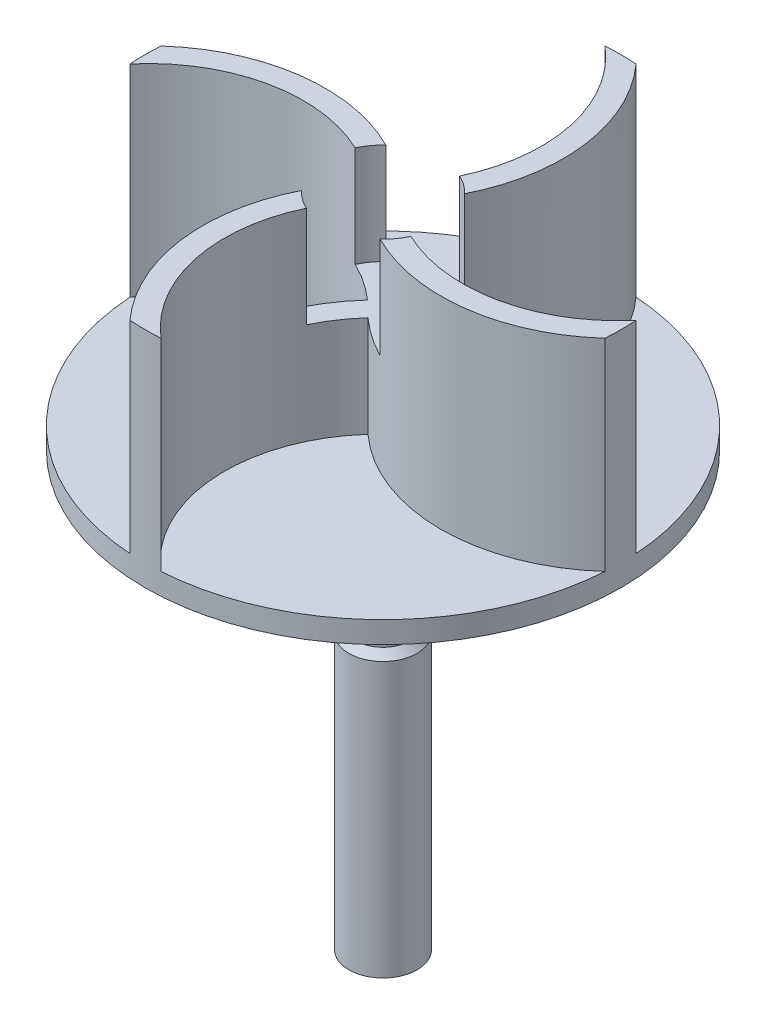
from build123d import *

# Parameters (mm, degrees)
SKETCH1_R           = 33
BOSS_EXTRUDE1_DEPTH = 3
BOSS_EXTRUDE3_DEPTH = 28
CIRPATTERN2_COUNT   = 4
SKETCH4_R           = 8
CUT_EXTRUDE1_DEPTH  = 14
SKETCH5_R           = 4.75
BOSS_EXTRUDE4_DEPTH = 60


with BuildPart() as part:
    # Sketch1 → Boss-Extrude1 (new body)
    with BuildSketch(Plane(origin=(0, 0, 0), x_dir=(1, 0, 0), z_dir=(0, 1, 0))):
        with Locations(Location((0, 0, 0), (0, 0, 270))):
            Circle(SKETCH1_R)
    extrude(amount=BOSS_EXTRUDE1_DEPTH)

    # Sketch3 → Boss-Extrude3 (add)
    with BuildSketch(Plane(origin=(0, 3, 0), x_dir=(1, 0, 0), z_dir=(0, 1, 0))):
        with BuildLine():
            Line((1.076086957, 1.045005676), (-1.076086957, -1.045005676))
            ThreePointArc((-1.076086957, -1.045005676), (15.703563953, -8.46363111), (32.929819694, -2.151040426))
            ThreePointArc((32.929819694, -2.151040426), (32.999999926, 0.002211213), (32.929531131, 2.155453428))
            ThreePointArc((32.929531131, 2.155453428), (17.249059735, -5.463527063), (1.076086957, 1.045005676))
        make_face()
    boss_extrude3 = extrude(amount=BOSS_EXTRUDE3_DEPTH)

    # CirPattern2: Boss-Extrude3 ×4 about axis
    cirpattern2_axis = Axis((0, 0, 0), (0, 1, 0))
    for i in range(1, CIRPATTERN2_COUNT):
        add(boss_extrude3.rotate(cirpattern2_axis, i * 360 / CIRPATTERN2_COUNT))

    # Sketch4 → Cut-Extrude1 (cut)
    with BuildSketch(Plane(origin=(0, 31, 0), x_dir=(1, 0, 0), z_dir=(0, 1, 0))):
        Circle(SKETCH4_R)
    extrude(amount=-CUT_EXTRUDE1_DEPTH, mode=Mode.SUBTRACT)

    # Sketch5 → Boss-Extrude4 (add)
    with BuildSketch(Plane.XZ):
        with Locations(Location((0, 0, 0), (0, 0, 90))):
            Circle(SKETCH5_R)
    extrude(amount=BOSS_EXTRUDE4_DEPTH)

    # Sketch6 → Cut-Revolve1 (revolve, cut)
    with BuildSketch(Plane.XY, mode=Mode.PRIVATE) as cut_revolve1_sk:
        Polygon((-4.75, -16), (-3.75, -17), (-3.75, -21), (-4.75, -22), align=None)
    revolve(cut_revolve1_sk.sketch.rotate(Axis((0, 0, 0), (0, -1, 0)), 270), axis=Axis((0, 0, 0), (0, -1, 0)), mode=Mode.SUBTRACT)


solid = part.part
